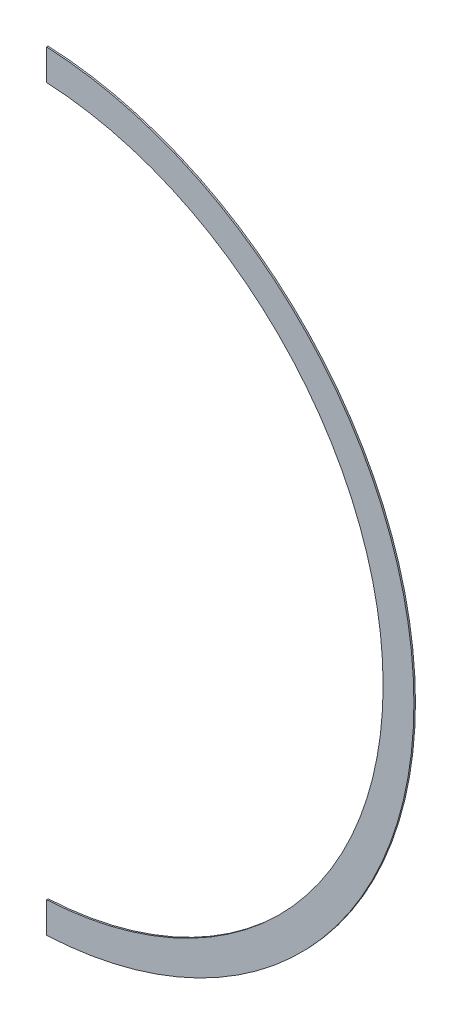
from build123d import *

# Parameters (mm, degrees)
BOSS_EXTRUDE1_DEPTH = 0.75


with BuildPart() as part:
    # Sketch1 → Boss-Extrude1 (new, symmetric)
    with BuildSketch(Plane.XY):
        with BuildLine():
            Line((17.5, 339.574734042), (17.5, 369.607435445))
            ThreePointArc((17.5, 369.607435445), (375.230263158, -4.994695074), (17.5, -379.596825593))
            Line((17.5, -379.596825593), (17.5, -349.56222622))
            ThreePointArc((17.5, -349.56222622), (345.25, -4.993746089), (17.5, 339.574734042))
        make_face()
    extrude(amount=BOSS_EXTRUDE1_DEPTH, both=True)


solid = part.part
